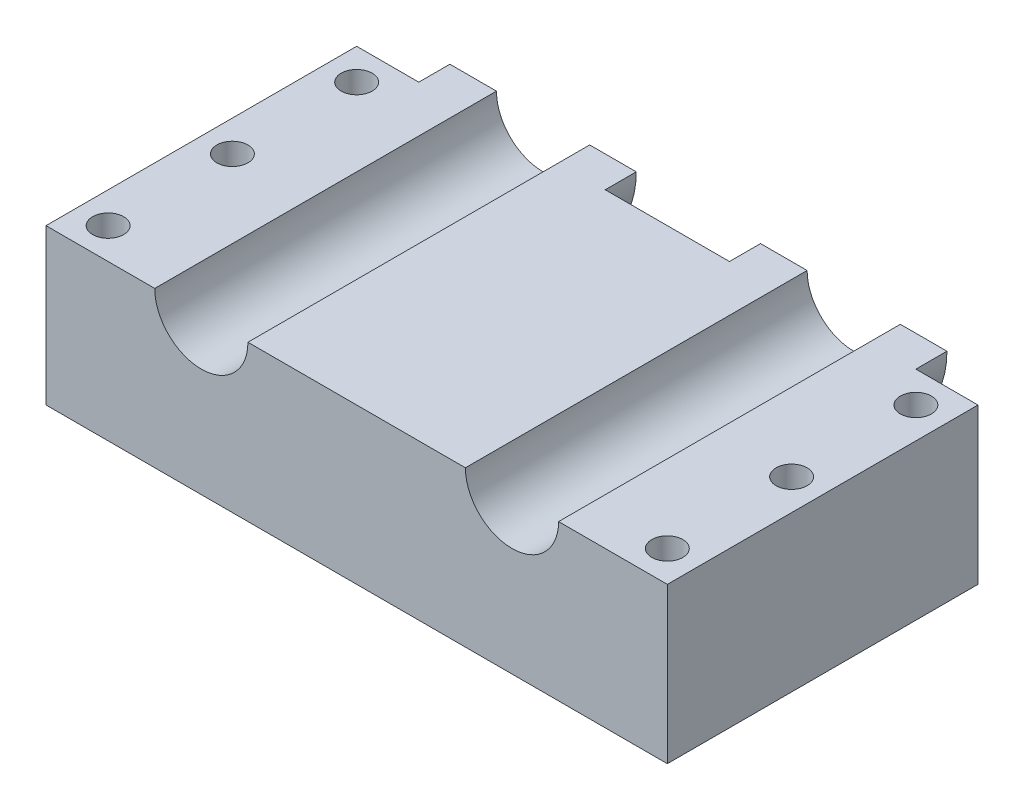
from build123d import *

# Parameters (mm, degrees)
SKETCH1_R               = 6.35000000000001
SKETCH1_R_2             = 6.349999999999968
SKETCH1_R_3             = 6.350000000000001
SKETCH1_R_4             = 6.350000000000003
SKETCH1_R_5             = 6.3499999999999375
SKETCH1_R_6             = 6.349999999999967
BOSS_EXTRUDE3_DEPTH     = 63.5
BOSS_EXTRUDE9_DEPTH     = 12.7
CUT_EXTRUDE5_DEPTH      = 291.99355662969583
CUT_EXTRUDE5_DEPTH_BACK = 291.99355662969583


with BuildPart() as part:
    # Sketch1 → Boss-Extrude3 (new body)
    with BuildSketch(Plane(origin=(0, 0, 0), x_dir=(1, 0, 0), z_dir=(0, 1, 0))):
        Polygon((254, 0), (0, 0), (1.555e-14, -127), (254, -127), align=None)
        with Locations((12.700000000000053, -114.3)):
            Circle(SKETCH1_R, mode=Mode.SUBTRACT)
        with Locations((241.30000000000004, -114.3)):
            Circle(SKETCH1_R_2, mode=Mode.SUBTRACT)
        with Locations((12.699999999999523, -63.5)):
            Circle(SKETCH1_R_3, mode=Mode.SUBTRACT)
        with Locations((12.69999999999899, -12.700000000000003)):
            Circle(SKETCH1_R_4, mode=Mode.SUBTRACT)
        with Locations((241.29999999999953, -63.5)):
            Circle(SKETCH1_R_5, mode=Mode.SUBTRACT)
        with Locations((241.299999999999, -12.700000000000003)):
            Circle(SKETCH1_R_6, mode=Mode.SUBTRACT)
    extrude(amount=BOSS_EXTRUDE3_DEPTH)

    # Sketch3 → Boss-Extrude9 (add)
    with BuildSketch(Plane(origin=(0, 0, 0), x_dir=(-1, 0, 0), z_dir=(0, 0, -1))):
        with BuildLine():
            Line((-82.55000000000001, 63.5), (-101.6, 63.5))
            ThreePointArc((-101.6, 63.49999999999999), (-63.5, 25.400000000000006), (-25.400000000000006, 63.5))
            Line((-25.400000000000006, 63.5), (-44.44999999999999, 63.5))
            ThreePointArc((-44.44999999999999, 63.5), (-63.5, 44.44999999999999), (-82.55000000000001, 63.5))
        make_face()
        with BuildLine():
            ThreePointArc((-228.6, 63.5), (-190.5, 25.400000000000013), (-152.4, 63.49999999999999))
            Line((-152.4, 63.5), (-171.45, 63.5))
            ThreePointArc((-171.45, 63.5), (-190.5, 44.44999999999999), (-209.55, 63.5))
            Line((-209.55, 63.5), (-228.6, 63.5))
        make_face()
    extrude(amount=BOSS_EXTRUDE9_DEPTH)

    # Sketch3<12> → Cut-Extrude5 (cut, two sides: drawn at the far end of the back side and taken through both)
    with BuildSketch(Plane(origin=(0, 0, 0), x_dir=(-1, 0, 0), z_dir=(0, 0, -1)).offset(-CUT_EXTRUDE5_DEPTH_BACK)):
        with BuildLine():
            Line((-44.44999999999999, 63.5), (-82.55000000000001, 63.5))
            ThreePointArc((-82.55000000000001, 63.5), (-63.5, 44.44999999999999), (-44.44999999999999, 63.5))
        make_face()
        with BuildLine():
            ThreePointArc((-209.55, 63.5), (-190.5, 44.44999999999999), (-171.45, 63.5))
            Line((-171.45, 63.5), (-209.55, 63.5))
        make_face()
    extrude(amount=CUT_EXTRUDE5_DEPTH + CUT_EXTRUDE5_DEPTH_BACK, mode=Mode.SUBTRACT)


solid = part.part
